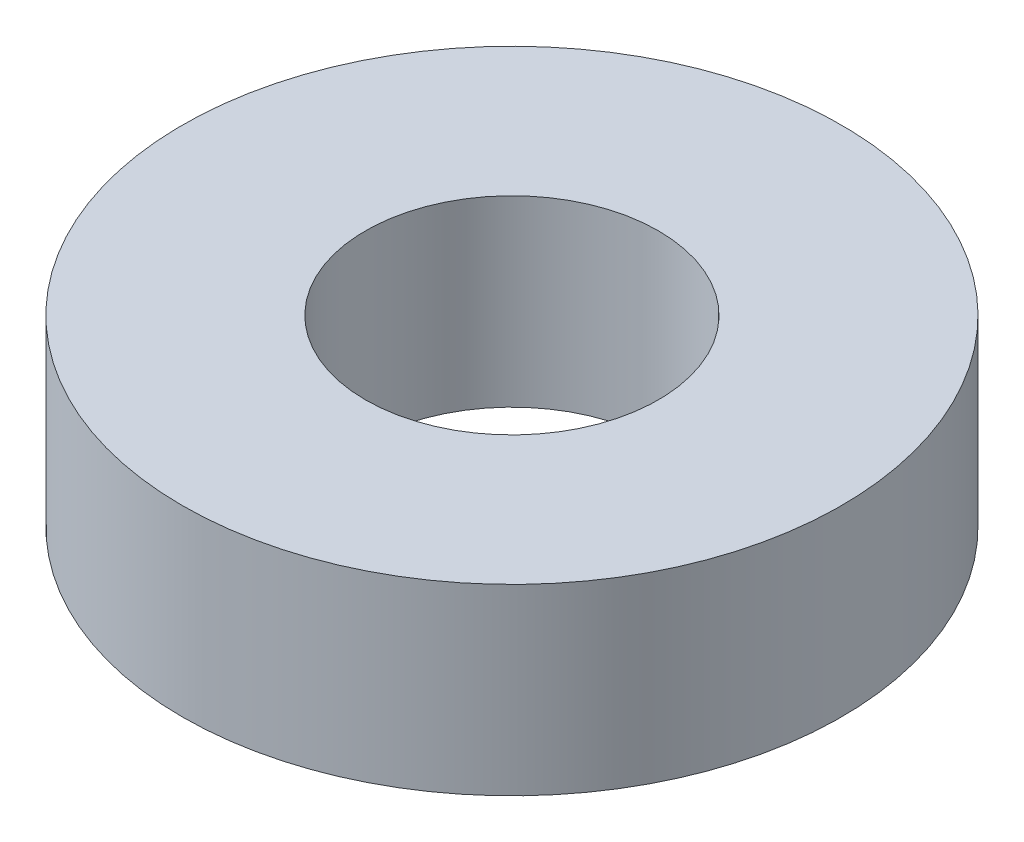
from build123d import *

# Parameters (mm, degrees)
SKETCH_1_R      = 9
SKETCH_1_R_2    = 4
EXTRUDE_1_DEPTH = 5


with BuildPart() as part:
    # 草图1 → 拉伸1 (new body)
    with BuildSketch(Plane(origin=(0, 0, 0), x_dir=(1, 0, 0), z_dir=(0, 1, 0))):
        with Locations(Location((0, 0, 0), (0, 0, 270))):
            Circle(SKETCH_1_R)
        with Locations(Location((0, 0, 0), (0, 0, 270))):
            Circle(SKETCH_1_R_2, mode=Mode.SUBTRACT)
    extrude(amount=EXTRUDE_1_DEPTH)


solid = part.part
